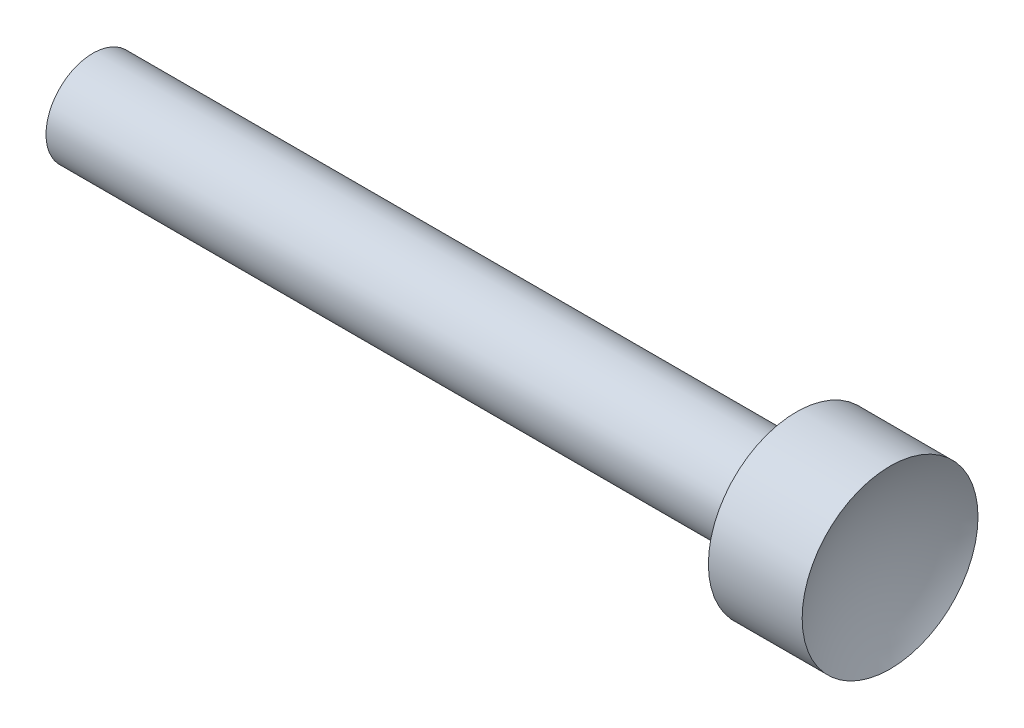
from build123d import *


with BuildPart() as part:
    # Sketch1 → Revolve1 (revolve)
    with BuildSketch(Plane.XY, mode=Mode.PRIVATE) as revolve1_sk:
        with BuildLine():
            Line((66.43692, 4), (66.43692, 7.5))
            Line((66.43692, 7.5), (74.43692, 7.5))
            ThreePointArc((74.43692, 7.5), (72.938413662, 3.882285677), (72.427301057, 0))
            Line((72.427301057, 0), (6.43692, 0))
            Line((6.43692, 0), (6.43692, 4))
            Line((6.43692, 4), (66.43692, 4))
        make_face()
    revolve(revolve1_sk.sketch.rotate(Axis((0, 0, 0), (1, 0, 0)), 90), axis=Axis((0, 0, 0), (1, 0, 0)))


solid = part.part
